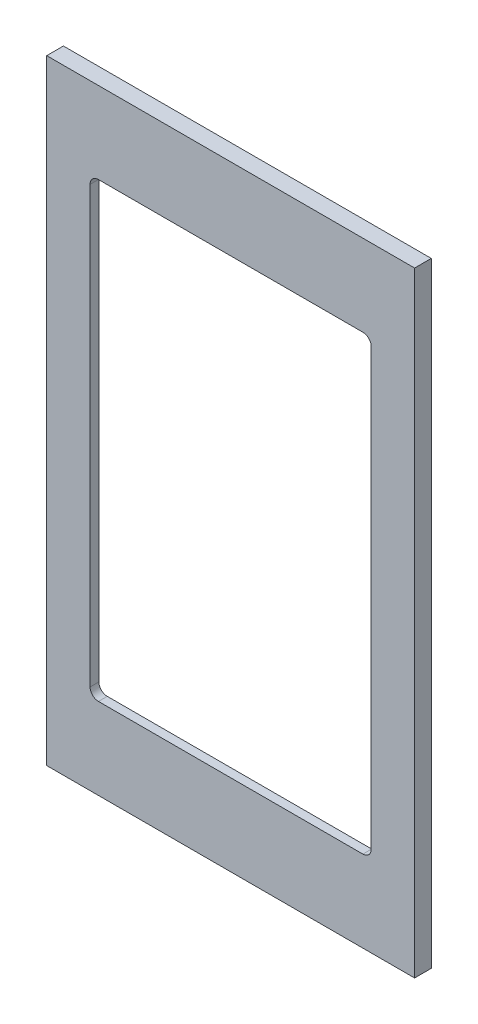
from build123d import *

# Parameters (mm, degrees)
SKETCH1_W           = 140
SKETCH1_H           = 234
BOSS_EXTRUDE1_DEPTH = 6.35
SKETCH2_W           = 107
SKETCH2_H           = 172
CUT_EXTRUDE1_DEPTH  = 137.489276136
FILLET1_R           = 3.175
SKETCH3_W           = 125
SKETCH3_H           = 210
CUT_EXTRUDE2_DEPTH  = 3
FILLET2_R           = 3.175
SKETCH5_W           = 6
SKETCH5_H           = 40
CUT_EXTRUDE4_DEPTH  = 20
SKETCH6_W           = 0.5
SKETCH6_H           = 40
BOSS_EXTRUDE2_DEPTH = 3


with BuildPart() as part:
    # Sketch1 → Boss-Extrude1 (new body)
    with BuildSketch(Plane.XY):
        Rectangle(SKETCH1_W, SKETCH1_H)
    extrude(amount=BOSS_EXTRUDE1_DEPTH)

    # Sketch2 → Cut-Extrude1 (cut, through all)
    with BuildSketch(Plane.XY.offset(6.35)):
        Rectangle(SKETCH2_W, SKETCH2_H)
    extrude(amount=-CUT_EXTRUDE1_DEPTH, mode=Mode.SUBTRACT)

    # Fillet1
    fillet1_edges = [part.edges().sort_by_distance(p)[0] for p in [
        (53.5, 86, 3.175),
        (53.5, -86, 3.175),
        (-53.5, -86, 3.175),
        (-53.5, 86, 3.175),
    ]]
    fillet(fillet1_edges, radius=FILLET1_R)

    # Sketch3 → Cut-Extrude2 (cut)
    with BuildSketch(Plane(origin=(0, 0, 0), x_dir=(-1, 0, 0), z_dir=(0, 0, -1))):
        Rectangle(SKETCH3_W, SKETCH3_H)
    extrude(amount=-CUT_EXTRUDE2_DEPTH, mode=Mode.SUBTRACT)

    # Fillet2
    fillet2_edges = [part.edges().sort_by_distance(p)[0] for p in [
        (-62.5, 105, 1.5),
        (-62.5, -105, 1.5),
        (62.5, -105, 1.5),
        (62.5, 105, 1.5),
    ]]
    fillet(fillet2_edges, radius=FILLET2_R)

    # Sketch5 → Cut-Extrude4 (cut)
    with BuildSketch(Plane(origin=(70, 0, 0), x_dir=(0, 0, -1), z_dir=(1, 0, 0))):
        with Locations((0, 2)):
            Rectangle(SKETCH5_W, SKETCH5_H)
    extrude(amount=-CUT_EXTRUDE4_DEPTH, mode=Mode.SUBTRACT)

    # Sketch6 → Boss-Extrude2 (add)
    with BuildSketch(Plane(origin=(0, 0, 3), x_dir=(-1, 0, 0), z_dir=(0, 0, -1))):
        with Locations((-69.75, 2)):
            Rectangle(SKETCH6_W, SKETCH6_H)
    extrude(amount=BOSS_EXTRUDE2_DEPTH)


solid = part.part
